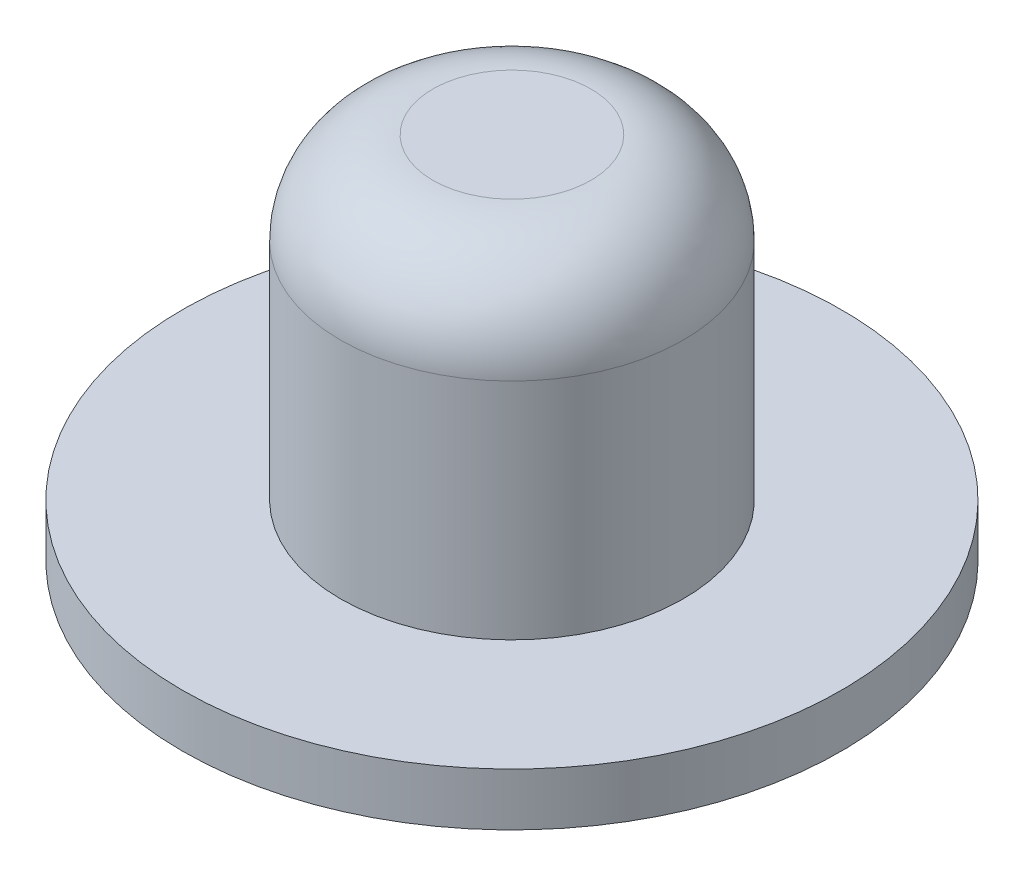
from build123d import *

# Parameters (mm, degrees)
ESQUISSE1_R        = 12.5
BOSS_EXTRU_1_DEPTH = 2
ESQUISSE2_R        = 6.5
BOSS_EXTRU_2_DEPTH = 12
CONG_1_R           = 3.5


with BuildPart() as part:
    # Esquisse1 → Boss.-Extru.1 (new body)
    with BuildSketch(Plane(origin=(0, 0, 0), x_dir=(1, 0, 0), z_dir=(0, 1, 0))):
        with Locations(Location((0, 0, 0), (0, 0, 270))):
            Circle(ESQUISSE1_R)
    extrude(amount=BOSS_EXTRU_1_DEPTH)

    # Esquisse2 → Boss.-Extru.2 (add)
    with BuildSketch(Plane(origin=(0, 2, 0), x_dir=(1, 0, 0), z_dir=(0, 1, 0))):
        with Locations(Location((0, 0, 0), (0, 0, 270))):
            Circle(ESQUISSE2_R)
    extrude(amount=BOSS_EXTRU_2_DEPTH)

    # Congé1
    cong_1_edges = [part.edges().sort_by_distance(p)[0] for p in [
        (0, 14, -6.5),
    ]]
    fillet(cong_1_edges, radius=CONG_1_R)


solid = part.part
